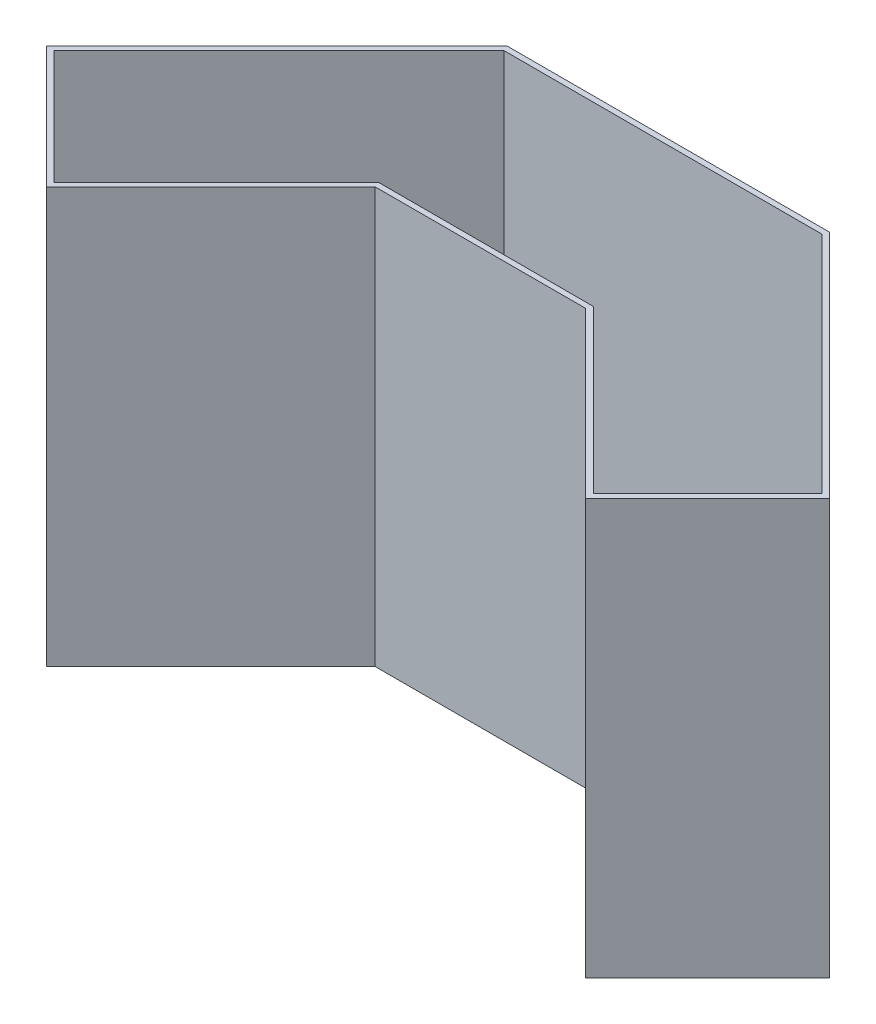
from build123d import *

# Parameters (mm, degrees)
EXTRUDE_1_DEPTH = 150


with BuildPart() as part:
    # 草图1 → 凸台-拉伸1 (new body)
    with BuildSketch(Plane(origin=(0, 0, 0), x_dir=(1, 0, 0), z_dir=(0, 1, 0))):
        Polygon((-141.410357001, -81.179415022), (-97.370260274, -125.21951175), (-38.005646949, -65.854898425), (38.005646949, -65.854898425), (97.370260274, -125.21951175), (141.410357001, -81.179415022), (58.23094198, 2), (-58.23094198, 2), align=None)
        Polygon((-57.402514855, 0), (57.402514855, 0), (138.581929877, -81.179415022), (97.370260274, -122.391084625), (38.834074074, -63.854898425), (-38.834074074, -63.854898425), (-97.370260274, -122.391084625), (-138.581929877, -81.179415022), align=None, mode=Mode.SUBTRACT)
    extrude(amount=EXTRUDE_1_DEPTH)


solid = part.part
